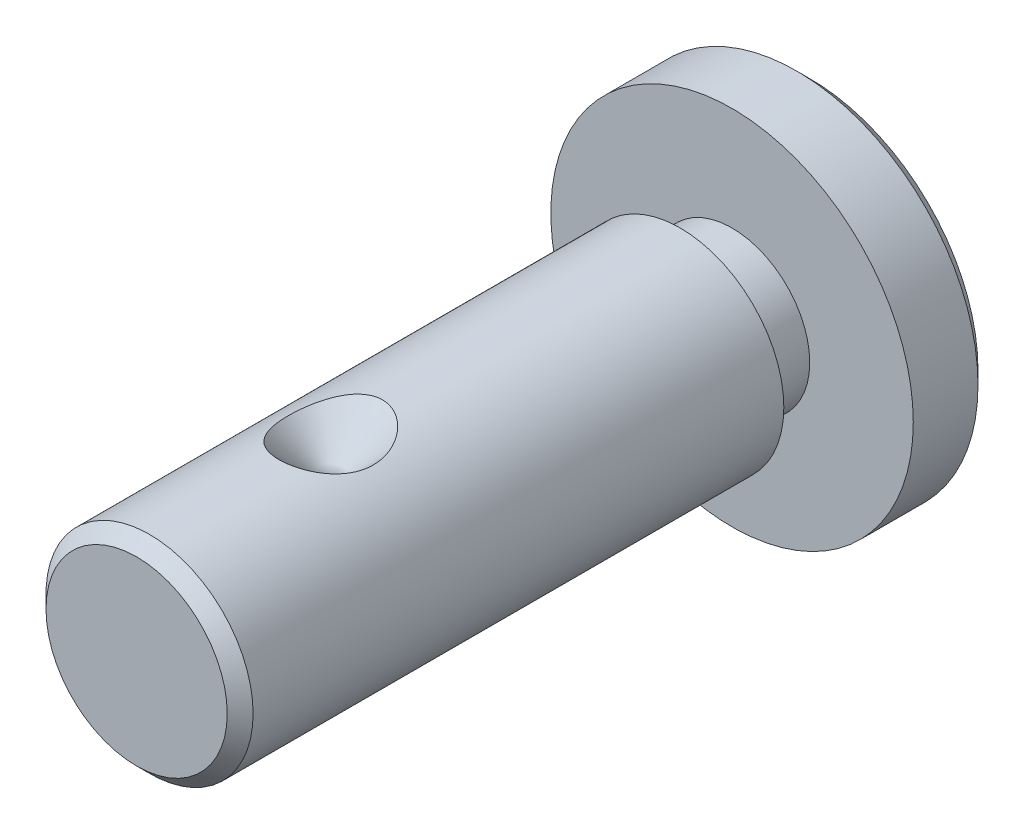
from build123d import *

# Parameters (mm, degrees)
SKETCH_1_R          = 7
EXTRUDE_1_DEPTH     = 3
SKETCH_2_R          = 4
EXTRUDE_2_DEPTH     = 23
SKETCH_3_OUTSIDE_W  = 22.536
SKETCH_3_OUTSIDE_H  = 22.536
SKETCH_3_OUTSIDE_R  = 3
CUT_EXTRUDE_1_DEPTH = 2
CHAMFER_1_SIZE      = 0.5


with BuildPart() as part:
    # 草图1 → 凸台-拉伸1 (new body)
    with BuildSketch(Plane.XY):
        Circle(SKETCH_1_R)
    extrude(amount=EXTRUDE_1_DEPTH)

    # 草图2 → 凸台-拉伸2 (add)
    with BuildSketch(Plane.XY.offset(3)):
        Circle(SKETCH_2_R)
    extrude(amount=EXTRUDE_2_DEPTH)

    # 草图3 outside → 切除-拉伸1 (cut)
    with BuildSketch(Plane.XY.offset(3)):
        Rectangle(SKETCH_3_OUTSIDE_W, SKETCH_3_OUTSIDE_H)
        Circle(SKETCH_3_OUTSIDE_R, mode=Mode.SUBTRACT)
    extrude(amount=CUT_EXTRUDE_1_DEPTH, mode=Mode.SUBTRACT)

    # 倒角1
    chamfer_1_edges = [part.edges().sort_by_distance(p)[0] for p in [
        (-7, 0, 0),
        (-4, 0, 26),
    ]]
    chamfer(chamfer_1_edges, length=CHAMFER_1_SIZE)

    # 草图4 → 切除-旋转1 (revolve, cut)
    with BuildSketch(Plane(origin=(0, 0, 0), x_dir=(0, 0, -1), z_dir=(1, 0, 0)), mode=Mode.PRIVATE) as cut_revolve_1_sk:
        Polygon((-18.5, 2), (-16.5, 4), (-18.5, 4), align=None)
    revolve(cut_revolve_1_sk.sketch.rotate(Axis((0, 6.943953148, 18.5), (0, -1, 0)), 180), axis=Axis((0, 6.943953148, 18.5), (0, -1, 0)), mode=Mode.SUBTRACT)


solid = part.part
